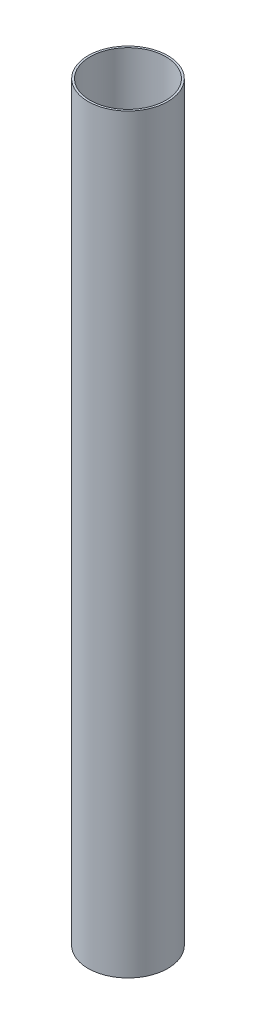
from build123d import *

# Parameters (mm, degrees)
SKETCH1_R           = 32.9
SKETCH1_R_2         = 31.25
BOSS_EXTRUDE1_DEPTH = 620


with BuildPart() as part:
    # Sketch1 → Boss-Extrude1 (new body)
    with BuildSketch(Plane(origin=(0, 0, 0), x_dir=(1, 0, 0), z_dir=(0, 1, 0))):
        with Locations(Location((0, 0, 0), (0, 0, 270))):
            Circle(SKETCH1_R)
        with Locations(Location((0, 0, 0), (0, 0, 270))):
            Circle(SKETCH1_R_2, mode=Mode.SUBTRACT)
    extrude(amount=BOSS_EXTRUDE1_DEPTH)


solid = part.part
